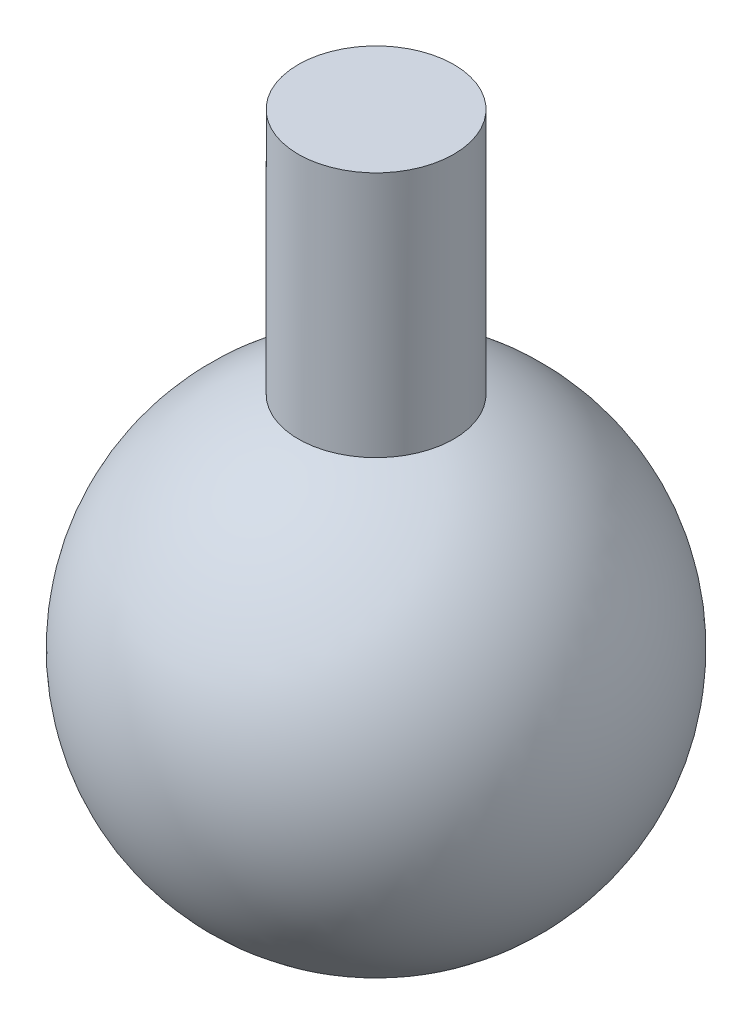
from build123d import *

# Parameters (mm, degrees)
SKETCH_2_R      = 1
EXTRUDE_1_DEPTH = 6


with BuildPart() as part:
    # 草图1 → 旋转1 (revolve)
    with BuildSketch(Plane(origin=(0, 0, 0), x_dir=(1, 0, 0), z_dir=(0, 1, 0))):
        with BuildLine():
            Line((0, 3), (0, -3))
            ThreePointArc((0, -3), (3, 0), (0, 3))
        make_face()
    revolve(axis=Axis((0, 0, -3), (0, 0, 1)))

    # 草图2 → 凸台-拉伸1 (add)
    with BuildSketch(Plane(origin=(0, 0, 0), x_dir=(1, 0, 0), z_dir=(0, 1, 0))):
        with Locations(Location((0, 0, 0), (0, 0, 90))):
            Circle(SKETCH_2_R)
    extrude(amount=EXTRUDE_1_DEPTH)


solid = part.part
